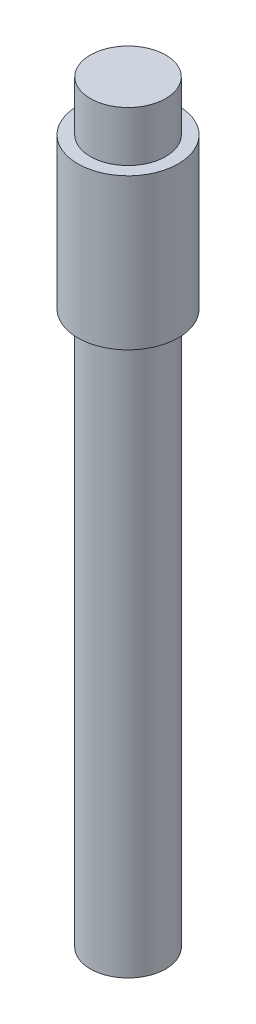
from build123d import *

# Parameters (mm, degrees)
SKETCH2_R          = 4.1
CUT_EXTRUDE1_DEPTH = 50


with BuildPart() as part:
    # Sketch1 → Revolve1 (revolve)
    with BuildSketch(Plane.XY, mode=Mode.PRIVATE) as revolve1_sk:
        Polygon((0, -75), (0, 75), (-7.5, 75), (-7.5, 65), (-10, 65), (-10, 35), (-7.5, 35), (-7.5, -75), align=None)
    revolve(revolve1_sk.sketch.rotate(Axis((0, -75, 0), (0, 1, 0)), 180), axis=Axis((0, -75, 0), (0, 1, 0)))

    # Sketch2 → Cut-Extrude1 (cut)
    with BuildSketch(Plane.XZ.offset(75)):
        Circle(SKETCH2_R)
    extrude(amount=-CUT_EXTRUDE1_DEPTH, mode=Mode.SUBTRACT)


solid = part.part
